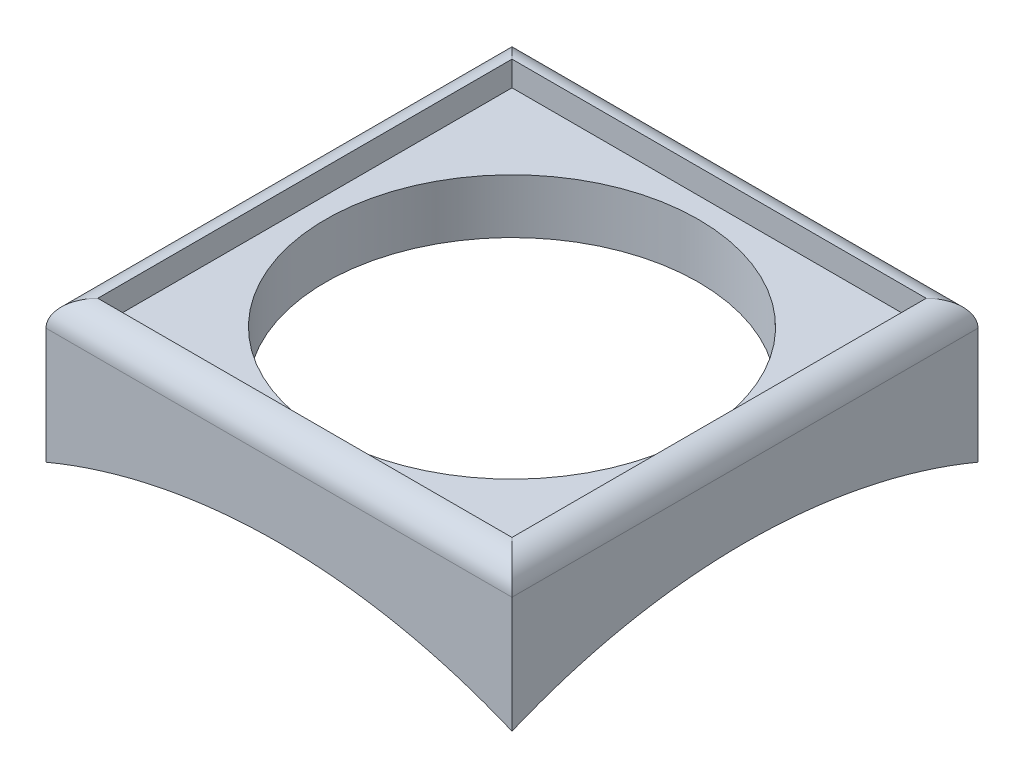
from build123d import *

# Parameters (mm, degrees)
SKETCH_1_W          = 54
SKETCH_1_H          = 54
EXTRUDE_1_DEPTH     = 27
SKETCH_2_W          = 54
SKETCH_2_H          = 54
SKETCH_2_W_2        = 18
SKETCH_2_H_2        = 18
CUT_EXTRUDE_1_DEPTH = 54
SKETCH_3_W          = 18
SKETCH_3_H          = 36
CUT_EXTRUDE_2_DEPTH = 34.674916481
FILLET_1_R          = 1
SCALE_1_SCALE       = 2.083333333
SKETCH_5_W          = 33.333333334
SKETCH_5_H          = 33.333333334
CUT_EXTRUDE_3_DEPTH = 2
SKETCH_6_R          = 15
CUT_EXTRUDE_4_DEPTH = 6


with BuildPart() as part:
    # 草图1 → 凸台-拉伸1 (new, symmetric)
    with BuildSketch(Plane.XY):
        Rectangle(SKETCH_1_W, SKETCH_1_H)
    extrude(amount=EXTRUDE_1_DEPTH, both=True)

    # 草图2 → 切除-拉伸1 (cut)
    with BuildSketch(Plane(origin=(0, 27, 0), x_dir=(1, 0, 0), z_dir=(0, 1, 0))):
        Rectangle(SKETCH_2_W, SKETCH_2_H)
        Rectangle(SKETCH_2_W_2, SKETCH_2_H_2, mode=Mode.SUBTRACT)
    extrude(amount=-CUT_EXTRUDE_1_DEPTH, mode=Mode.SUBTRACT)

    # 草图3 → 切除-拉伸2 (cut, through all)
    with BuildSketch(Plane.XY.offset(9)):
        with Locations((0, -9)):
            Rectangle(SKETCH_3_W, SKETCH_3_H)
    extrude(amount=-CUT_EXTRUDE_2_DEPTH, mode=Mode.SUBTRACT)

    # 草图4 → 切除-旋转1 (revolve, cut)
    with BuildSketch(Plane.XY):
        with BuildLine():
            Line((0, 25), (0, -25))
            ThreePointArc((0, -25), (-25, 0), (0, 25))
        make_face()
    revolve(axis=Axis((0, 25, 0), (0, -1, 0)), mode=Mode.SUBTRACT)

    # 圆角1
    fillet_1_edges = [part.edges().sort_by_distance(p)[0] for p in [
        (9, 27, 0),
        (0, 27, 9),
        (-9, 27, 0),
        (0, 27, -9),
    ]]
    fillet(fillet_1_edges, radius=FILLET_1_R)


with BuildPart() as part_1:
    # 缩放比例1: scaled about (0, 0, 0)
    add(part.part.scale(SCALE_1_SCALE))

    # 草图5 → 切除-拉伸3 (cut)
    with BuildSketch(Plane(origin=(0, 56.25, 0), x_dir=(1, 0, 0), z_dir=(0, 1, 0))):
        Rectangle(SKETCH_5_W, SKETCH_5_H)
    extrude(amount=-CUT_EXTRUDE_3_DEPTH, mode=Mode.SUBTRACT)

    # 草图6 → 切除-拉伸4 (cut)
    with BuildSketch(Plane(origin=(0, 54.25, 0), x_dir=(1, 0, 0), z_dir=(0, 1, 0))):
        with Locations(Location((0, 0, 0), (0, 0, 270))):
            Circle(SKETCH_6_R)
    extrude(amount=-CUT_EXTRUDE_4_DEPTH, mode=Mode.SUBTRACT)


solid = part_1.part
